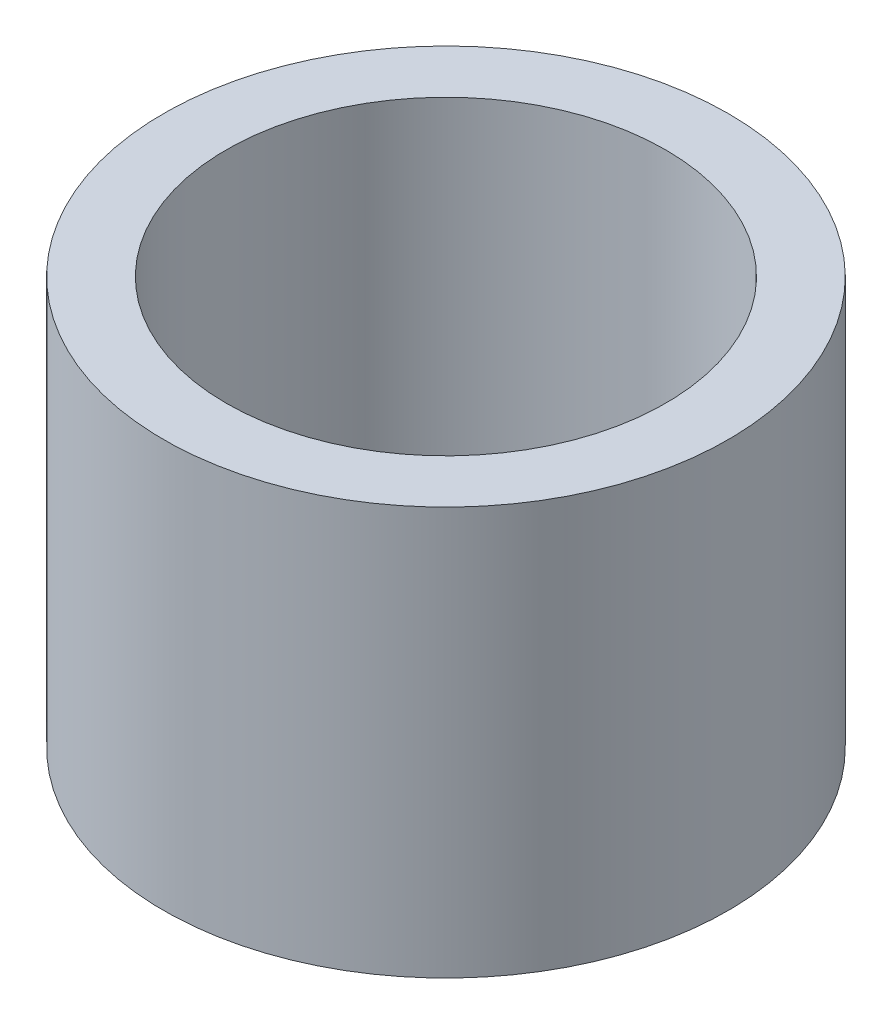
from build123d import *

# Parameters (mm, degrees)
CROQUIS1_R              = 9
CROQUIS1_R_2            = 7
SALIENTE_EXTRUIR1_DEPTH = 13


with BuildPart() as part:
    # Croquis1 → Saliente-Extruir1 (new body)
    with BuildSketch(Plane(origin=(0, 0, 0), x_dir=(1, 0, 0), z_dir=(0, 1, 0))):
        with Locations(Location((0, 0, 0), (0, 0, 90))):
            Circle(CROQUIS1_R)
        with Locations(Location((0, 0, 0), (0, 0, 90))):
            Circle(CROQUIS1_R_2, mode=Mode.SUBTRACT)
    extrude(amount=SALIENTE_EXTRUIR1_DEPTH)


solid = part.part
